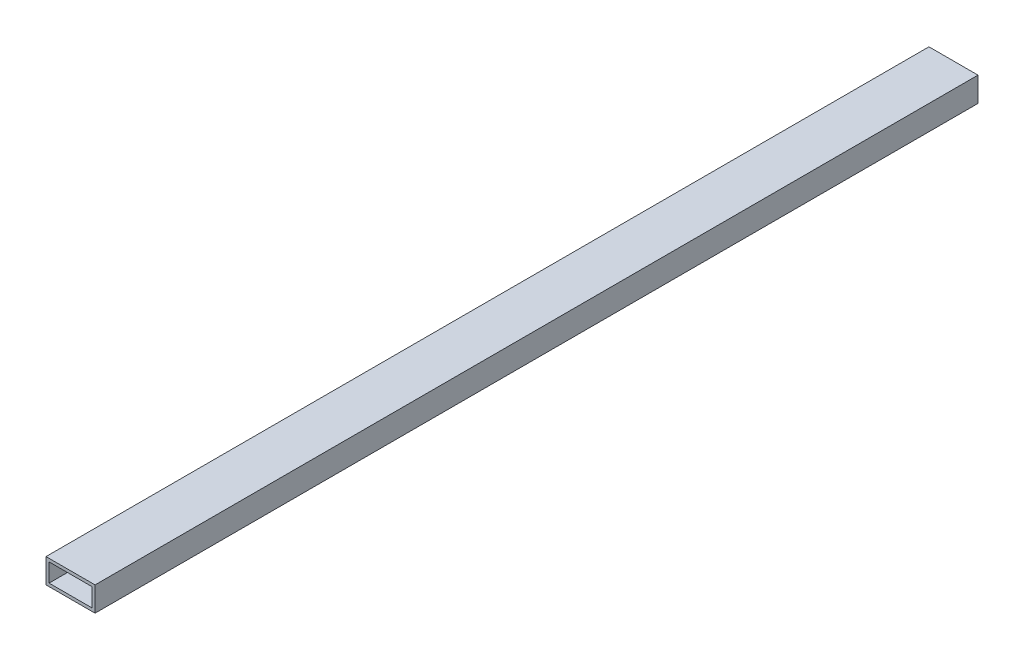
from build123d import *

# Parameters (mm, degrees)
BOSS_EXTRUDE1_DEPTH      = 457.2
BOSS_EXTRUDE1_DEPTH_BACK = 457.2
SKETCH3_W                = 50.8
SKETCH3_H                = 25.4
SKETCH3_W_2              = 44.45
SKETCH3_H_2              = 19.05


with BuildPart() as part:
    # Sketch3 → Boss-Extrude1 (new, two sides: drawn at the far end of the back side and taken through both)
    with BuildSketch(Plane.XY.offset(-BOSS_EXTRUDE1_DEPTH_BACK)):
        Rectangle(SKETCH3_W, SKETCH3_H)
        Rectangle(SKETCH3_W_2, SKETCH3_H_2, mode=Mode.SUBTRACT)
    extrude(amount=BOSS_EXTRUDE1_DEPTH + BOSS_EXTRUDE1_DEPTH_BACK)


solid = part.part
